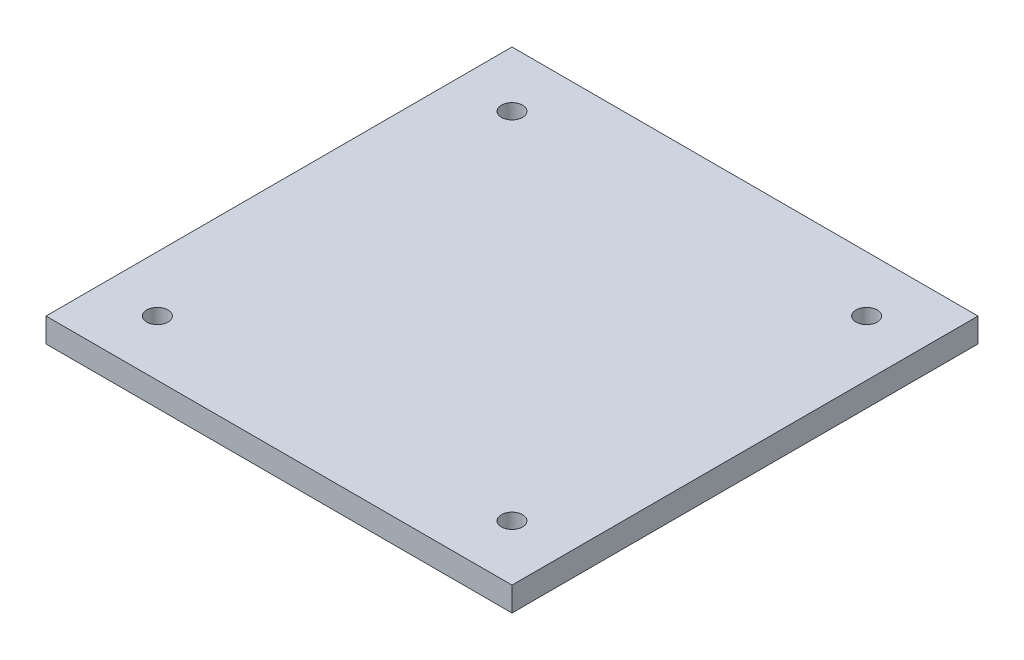
from build123d import *

# Parameters (mm, degrees)
SKETCH1_W                = 38.5
SKETCH1_H                = 38.5
BOSS_EXTRUDE1_DEPTH      = 2
M2_2X0_45_TAPPED_HOLE1_D = 1.75


with BuildPart() as part:
    # Sketch1 → Boss-Extrude1 (new body)
    with BuildSketch(Plane(origin=(0, 0, 0), x_dir=(1, 0, 0), z_dir=(0, 1, 0))):
        with Locations((-0.334475449, -6.202777778)):
            Rectangle(SKETCH1_W, SKETCH1_H)
    extrude(amount=BOSS_EXTRUDE1_DEPTH)

    # M2.2x0.45 Tapped Hole1 (through all)
    with Locations(Plane(origin=(-14.984475449, 2, -8.447222222), x_dir=(0, 0, 1), z_dir=(0, 1, 0))):
        with Locations((0, 0), (29.3, 29.3), (0, 29.3), (29.3, 0)):
            Hole(M2_2X0_45_TAPPED_HOLE1_D / 2)


solid = part.part
